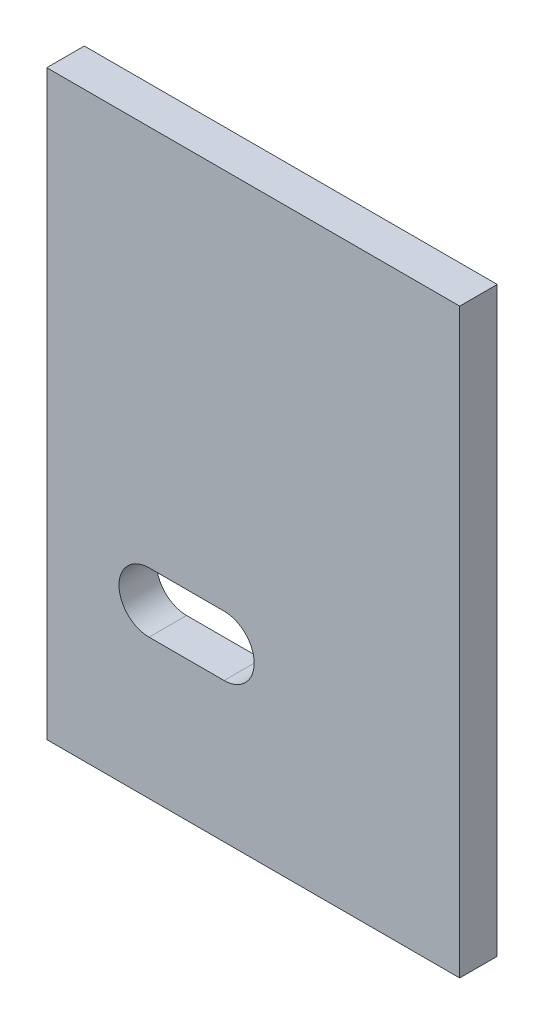
from build123d import *

# Parameters (mm, degrees)
SKETCH_1_W               = 110
SKETCH_1_H               = 155
EXTRUDE_1_DEPTH          = 10
CUT_EXTRUDE_1_DEPTH      = 96.557574268
CUT_EXTRUDE_1_DEPTH_BACK = 96.557574268


with BuildPart() as part:
    # 草图1 → 凸台-拉伸1 (new body)
    with BuildSketch(Plane.XY):
        Rectangle(SKETCH_1_W, SKETCH_1_H)
    extrude(amount=EXTRUDE_1_DEPTH)

    # 草图2 → 切除-拉伸1 (cut, two sides: drawn at the far end of the back side and taken through both)
    with BuildSketch(Plane.XY.offset(10).offset(-CUT_EXTRUDE_1_DEPTH_BACK)):
        with BuildLine():
            Line((-27.75, -24.25), (-7.75, -24.25))
            ThreePointArc((-7.75, -24.25), (0.25, -32.25), (-7.75, -40.25))
            Line((-7.75, -40.25), (-27.75, -40.25))
            ThreePointArc((-27.75, -40.25), (-35.75, -32.25), (-27.75, -24.25))
        make_face()
    extrude(amount=CUT_EXTRUDE_1_DEPTH + CUT_EXTRUDE_1_DEPTH_BACK, mode=Mode.SUBTRACT)


solid = part.part
